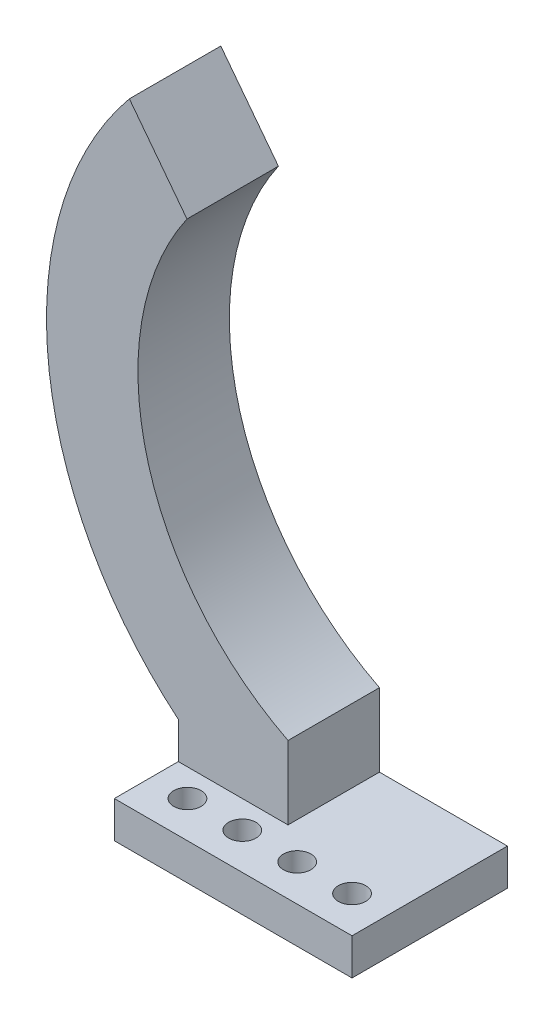
from build123d import *

# Parameters (mm, degrees)
BOSS_EXTRUDE1_DEPTH = 10
SKETCH3_W           = 26
SKETCH3_H           = 4
BOSS_EXTRUDE2_DEPTH = 17
SKETCH4_R           = 1.5
CUT_EXTRUDE1_DEPTH  = 4


with BuildPart() as part:
    # Sketch1 → Boss-Extrude1 (new body)
    with BuildSketch(Plane.XY):
        with BuildLine():
            Line((0.947795447, 55.867567374), (-5.354013975, 64.102890964))
            ThreePointArc((-5.354013975, 64.102890964), (-14.235235054, 34.948420067), (0, 8))
            Line((0, 8), (0, 4))
            Line((0, 4), (12, 4))
            Line((12, 4), (12, 12))
            ThreePointArc((12, 12), (-3.507060252, 31.419133439), (0.947795447, 55.867567374))
        make_face()
    extrude(amount=BOSS_EXTRUDE1_DEPTH)

    # Sketch3 → Boss-Extrude2 (add)
    with BuildSketch(Plane.XY):
        with Locations((13, 2)):
            Rectangle(SKETCH3_W, SKETCH3_H)
    extrude(amount=BOSS_EXTRUDE2_DEPTH)

    # Sketch4 → Cut-Extrude1 (cut)
    with BuildSketch(Plane(origin=(0, 4, 0), x_dir=(1, 0, 0), z_dir=(0, 1, 0))):
        with Locations(Location((4, -13, 0), (0, 0, 270))):
            Circle(SKETCH4_R)
        with Locations(Location((10, -13, 0), (0, 0, 270))):
            Circle(SKETCH4_R)
        with Locations(Location((16, -13, 0), (0, 0, 270))):
            Circle(SKETCH4_R)
        with Locations(Location((22, -13, 0), (0, 0, 270))):
            Circle(SKETCH4_R)
    extrude(amount=-CUT_EXTRUDE1_DEPTH, mode=Mode.SUBTRACT)


solid = part.part
